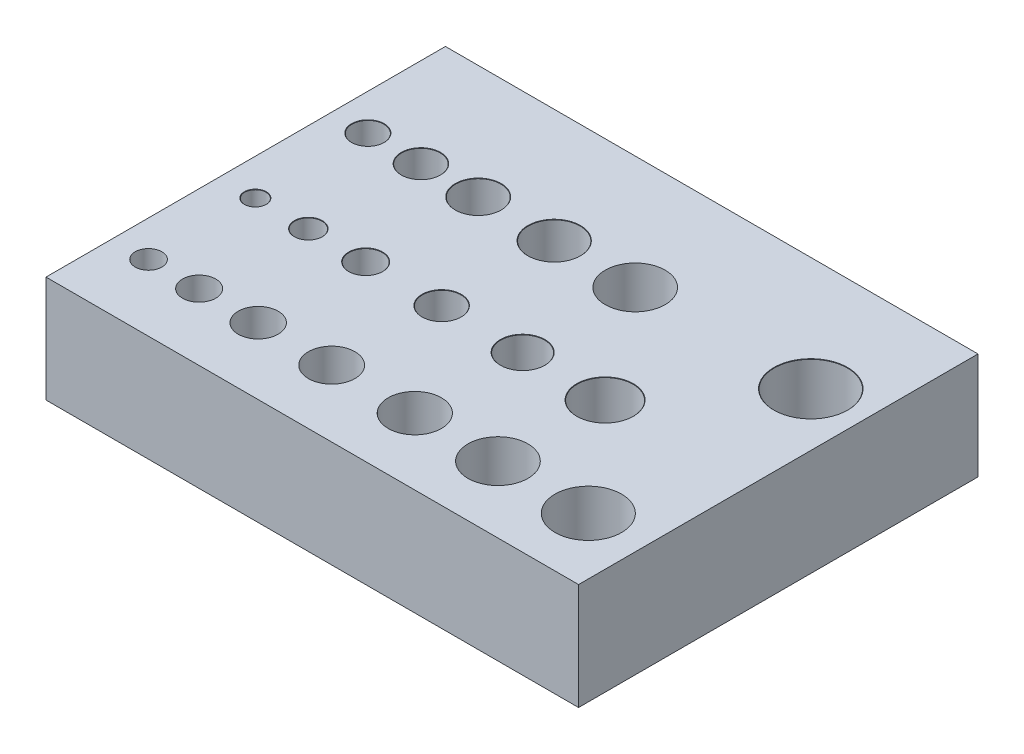
from build123d import *

# Parameters (mm, degrees)
SKETCH1_W            = 40
SKETCH1_H            = 30
SKETCH1_R            = 1
SKETCH1_R_2          = 1.25
SKETCH1_R_3          = 1.5
SKETCH1_R_4          = 1.75
SKETCH1_R_5          = 2
SKETCH1_R_6          = 2.25
SKETCH1_R_7          = 2.5
BOSS_EXTRUDE1_DEPTH  = 8
M4_CLEARANCE_HOLE1_D = 4.5
SKETCH27_R           = 1.5
CUT_EXTRUDE1_DEPTH   = 5


with BuildPart() as part:
    # Sketch1 → Boss-Extrude1 (new body)
    with BuildSketch(Plane(origin=(0, 0, 0), x_dir=(1, 0, 0), z_dir=(0, 1, 0))):
        with Locations((20, 15)):
            Rectangle(SKETCH1_W, SKETCH1_H)
        with Locations(Location((2.702313996, 5, 0), (0, 0, 270))):
            Circle(SKETCH1_R, mode=Mode.SUBTRACT)
        with Locations(Location((6.502577789, 5, 0), (0, 0, 270))):
            Circle(SKETCH1_R_2, mode=Mode.SUBTRACT)
        with Locations(Location((10.936495054, 5, 0), (0, 0, 270))):
            Circle(SKETCH1_R_3, mode=Mode.SUBTRACT)
        with Locations(Location((16.456979767, 5, 0), (0, 0, 270))):
            Circle(SKETCH1_R_4, mode=Mode.SUBTRACT)
        with Locations(Location((22.700422461, 5, 0), (0, 0, 270))):
            Circle(SKETCH1_R_5, mode=Mode.SUBTRACT)
        with Locations(Location((28.945995634, 5, 0), (0, 0, 270))):
            Circle(SKETCH1_R_6, mode=Mode.SUBTRACT)
        with Locations(Location((35.732366972, 5, 0), (0, 0, 270))):
            Circle(SKETCH1_R_7, mode=Mode.SUBTRACT)
    extrude(amount=BOSS_EXTRUDE1_DEPTH)

    # Sketch4 → Tap Drill for M2x0.4 Tap1 (revolve, cut)
    with BuildSketch(Plane(origin=(2.720220683, 8, -13), x_dir=(0, 0, 1), z_dir=(1, 0, 0))):
        Polygon((0, 0), (0, 8), (0.825, 8), (0.8, 7.975), (0.8, 0.025), (0.825, 0), align=None)
    revolve(axis=Axis((2.720220683, 14.35, -13), (0, -1, 0)), mode=Mode.SUBTRACT)

    # Sketch6 → Tap Drill for M2.5x0.45 Tap1 (revolve, cut)
    with BuildSketch(Plane(origin=(6.703721211, 8, -13), x_dir=(0, 0, 1), z_dir=(1, 0, 0))):
        Polygon((0, 0), (0, 8), (1.05, 8), (1.025, 7.975), (1.025, 0.025), (1.05, 0), align=None)
    revolve(axis=Axis((6.703721211, 14.35, -13), (0, -1, 0)), mode=Mode.SUBTRACT)

    # Sketch8 → Tap Drill for M3x0.5 Tap1 (revolve, cut)
    with BuildSketch(Plane(origin=(11.010208268, 8, -13), x_dir=(0, 0, 1), z_dir=(1, 0, 0))):
        Polygon((0, 0), (0, 8), (1.275, 8), (1.25, 7.975), (1.25, 0.025), (1.275, 0), align=None)
    revolve(axis=Axis((11.010208268, 14.35, -13), (0, -1, 0)), mode=Mode.SUBTRACT)

    # Sketch10 → Tap Drill for M3.5x0.6 Tap1 (revolve, cut)
    with BuildSketch(Plane(origin=(16.716303619, 8, -13), x_dir=(0, 0, 1), z_dir=(1, 0, 0))):
        Polygon((0, 0), (0, 8), (1.475, 8), (1.45, 7.975), (1.45, 0.025), (1.475, 0), align=None)
    revolve(axis=Axis((16.716303619, 14.35, -13), (0, -1, 0)), mode=Mode.SUBTRACT)

    # Sketch12 → Tap Drill for M4x0.7 Tap1 (revolve, cut)
    with BuildSketch(Plane(origin=(22.799216587, 8, -13), x_dir=(0, 0, 1), z_dir=(1, 0, 0))):
        Polygon((0, 0), (0, 8), (1.675, 8), (1.65, 7.975), (1.65, 0.025), (1.675, 0), align=None)
    revolve(axis=Axis((22.799216587, 14.35, -13), (0, -1, 0)), mode=Mode.SUBTRACT)

    # Sketch14 → Tap Drill for M5x0.8 Tap1 (revolve, cut)
    with BuildSketch(Plane(origin=(28.989791732, 8, -13), x_dir=(0, 0, 1), z_dir=(1, 0, 0))):
        Polygon((0, 0), (0, 8), (2.125, 8), (2.1, 7.975), (2.1, 0.025), (2.125, 0), align=None)
    revolve(axis=Axis((28.989791732, 14.35, -13), (0, -1, 0)), mode=Mode.SUBTRACT)

    # Sketch16 → M2 Clearance Hole1 (revolve, cut)
    with BuildSketch(Plane(origin=(2.720220683, 8, -21.453439382), x_dir=(0, 0, 1), z_dir=(1, 0, 0))):
        Polygon((0, 0), (0, 8), (1.225, 8), (1.2, 7.975), (1.2, 0.025), (1.225, 0), align=None)
    revolve(axis=Axis((2.720220683, 14.35, -21.453439382), (0, -1, 0)), mode=Mode.SUBTRACT)

    # Sketch18 → M2.5 Clearance Hole1 (revolve, cut)
    with BuildSketch(Plane(origin=(6.703721211, 8, -21.453439382), x_dir=(0, 0, 1), z_dir=(1, 0, 0))):
        Polygon((0, 0), (0, 8), (1.475, 8), (1.45, 7.975), (1.45, 0.025), (1.475, 0), align=None)
    revolve(axis=Axis((6.703721211, 14.35, -21.453439382), (0, -1, 0)), mode=Mode.SUBTRACT)

    # Sketch20 → M3 Clearance Hole1 (revolve, cut)
    with BuildSketch(Plane(origin=(11.010208268, 8, -21.453439382), x_dir=(0, 0, 1), z_dir=(1, 0, 0))):
        Polygon((0, 0), (0, 8), (1.725, 8), (1.7, 7.975), (1.7, 0.025), (1.725, 0), align=None)
    revolve(axis=Axis((11.010208268, 14.35, -21.453439382), (0, -1, 0)), mode=Mode.SUBTRACT)

    # Sketch22 → M3.5 Clearance Hole1 (revolve, cut)
    with BuildSketch(Plane(origin=(16.716303619, 8, -21.453439382), x_dir=(0, 0, 1), z_dir=(1, 0, 0))):
        Polygon((0, 0), (0, 8), (1.975, 8), (1.95, 7.975), (1.95, 0.025), (1.975, 0), align=None)
    revolve(axis=Axis((16.716303619, 14.35, -21.453439382), (0, -1, 0)), mode=Mode.SUBTRACT)

    # M4 Clearance Hole1 (through all)
    with Locations(Plane(origin=(0, 8, 0), x_dir=(1, 0, 0), z_dir=(0, 1, 0))):
        with Locations((22.799216587, 21.453439382)):
            Hole(M4_CLEARANCE_HOLE1_D / 2)

    # Sketch26 → M5 Clearance Hole1 (revolve, cut)
    with BuildSketch(Plane(origin=(35.9878332, 8, -21.453439382), x_dir=(0, 0, 1), z_dir=(1, 0, 0))):
        Polygon((0, 0), (0, 8), (2.775, 8), (2.75, 7.975), (2.75, 0.025), (2.775, 0), align=None)
    revolve(axis=Axis((35.9878332, 14.35, -21.453439382), (0, -1, 0)), mode=Mode.SUBTRACT)

    # Sketch27 → Cut-Extrude1 (cut)
    with BuildSketch(Plane(origin=(0, 0, -30), x_dir=(-1, 0, 0), z_dir=(0, 0, -1))):
        with Locations((-27.944979247, 3.833613)):
            Circle(SKETCH27_R)
    extrude(amount=-CUT_EXTRUDE1_DEPTH, mode=Mode.SUBTRACT)


solid = part.part
